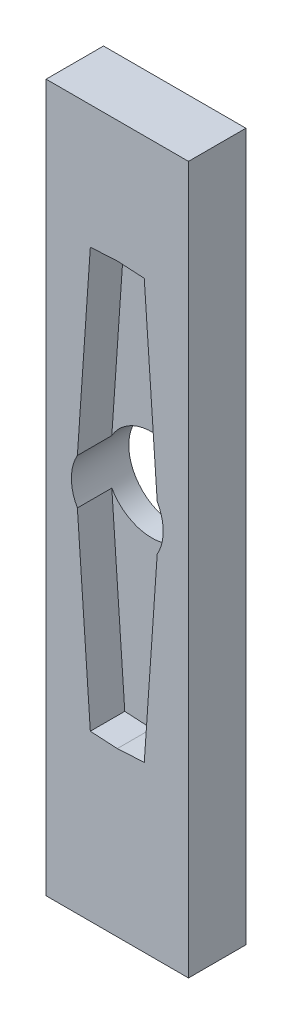
from build123d import *

# Parameters (mm, degrees)
BOSS_EXTRUDE1_DEPTH = 5
CUT_EXTRUDE1_DEPTH  = 3
SKETCH4_R           = 4
CUT_EXTRUDE2_DEPTH  = 5


with BuildPart() as part:
    # Sketch1 → Boss-Extrude1 (new body)
    with BuildSketch(Plane.XY):
        Polygon((6.2, -29), (6.2, -32.59), (-6.2, -32.59), (-6.2, -29), (-6.2, 29), (6.2, 29), align=None)
    extrude(amount=-BOSS_EXTRUDE1_DEPTH)

    # Sketch2 → Cut-Extrude1 (cut)
    with BuildSketch(Plane.XY):
        Polygon((-3.613807992, 0), (-2.3482015, 18.253803872), (0, 18.387804485), (2.3482015, 18.253803872), (3.613807992, 0), (2.3482015, -18.253803872), (0, -18.387804485), (-2.3482015, -18.253803872), align=None)
    extrude(amount=-CUT_EXTRUDE1_DEPTH, mode=Mode.SUBTRACT)

    # Sketch4 → Cut-Extrude2 (cut)
    with BuildSketch(Plane.XY):
        Circle(SKETCH4_R)
    extrude(amount=-CUT_EXTRUDE2_DEPTH, mode=Mode.SUBTRACT)


solid = part.part
